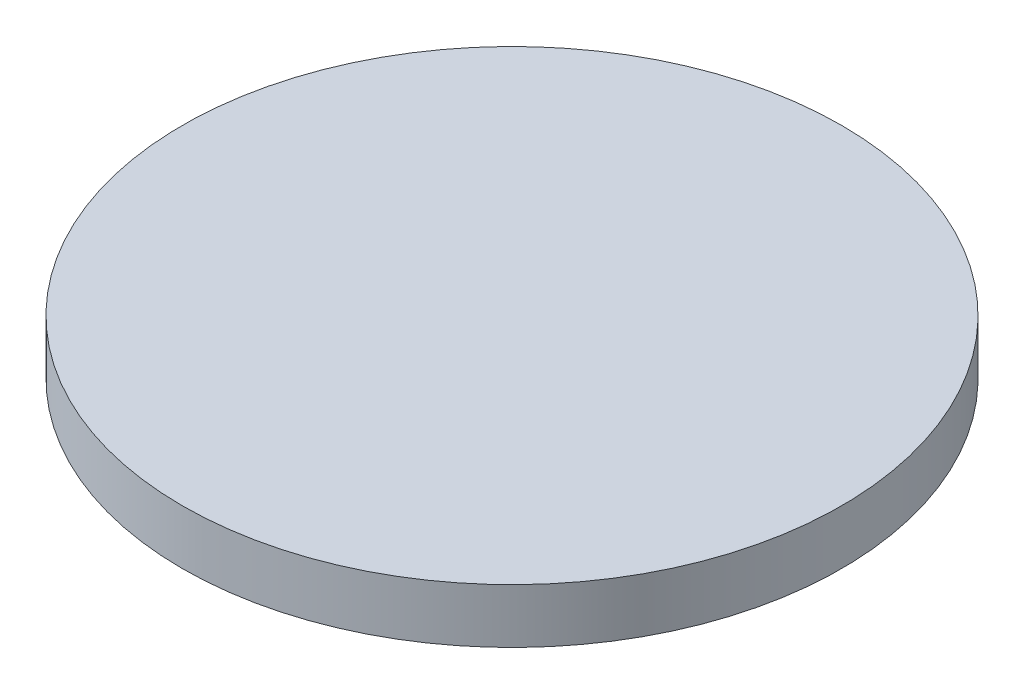
from build123d import *

# Parameters (mm, degrees)
SKETCH1_R           = 10.9
BOSS_EXTRUDE1_DEPTH = 1.8


with BuildPart() as part:
    # Sketch1 → Boss-Extrude1 (new body)
    with BuildSketch(Plane(origin=(0, 0, 0), x_dir=(1, 0, 0), z_dir=(0, 1, 0))):
        with Locations(Location((0, 0, 0), (0, 0, 270))):
            Circle(SKETCH1_R)
    extrude(amount=BOSS_EXTRUDE1_DEPTH)


solid = part.part
